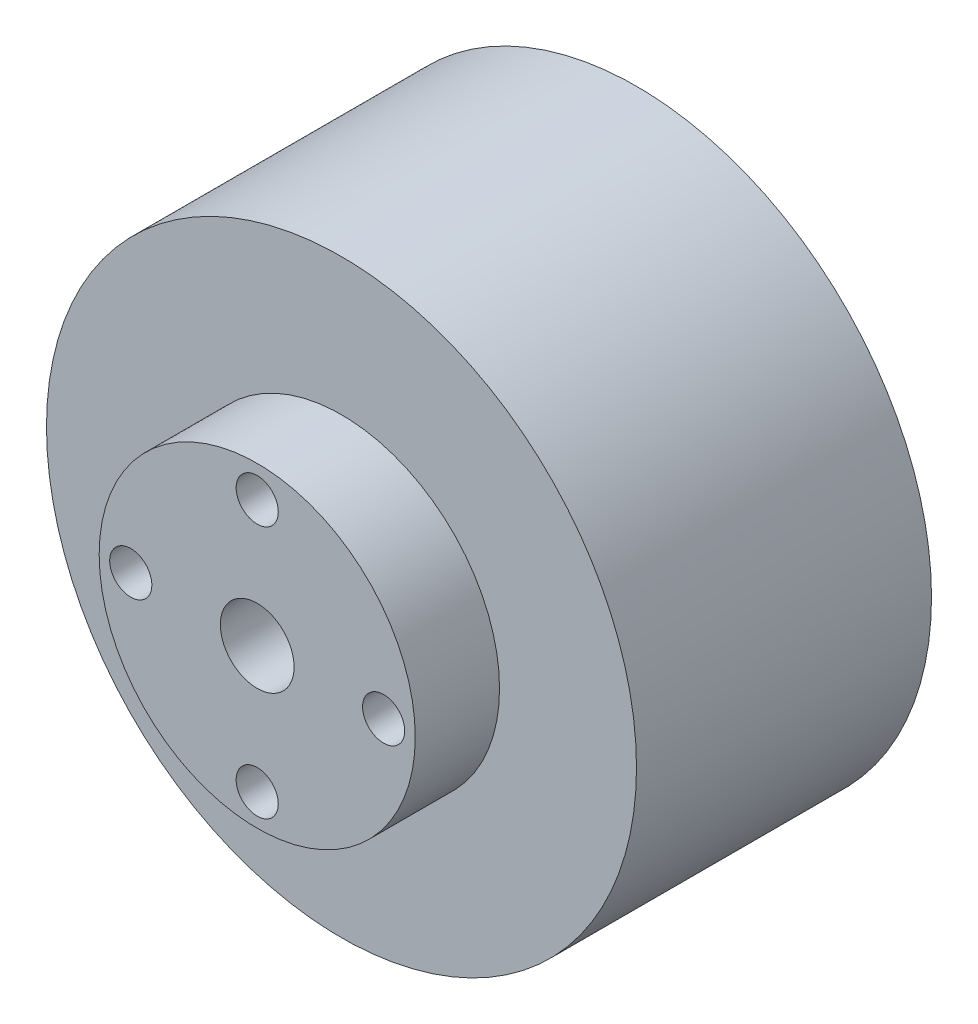
from build123d import *

# Parameters (mm, degrees)
SKETCH_1_R          = 14
EXTRUDE_1_DEPTH     = 14
SKETCH_3_R          = 7.5
EXTRUDE_3_DEPTH     = 4
SKETCH_4_R          = 1.75
CUT_EXTRUDE_1_DEPTH = 27.758176321
SKETCH_5_R          = 1
CUT_EXTRUDE_2_DEPTH = 3
SKETCH_6_R          = 1.5
CUT_EXTRUDE_3_DEPTH = 3


with BuildPart() as part:
    # 草图1 → 凸台-拉伸1 (new body)
    with BuildSketch(Plane.XY):
        Circle(SKETCH_1_R)
    extrude(amount=EXTRUDE_1_DEPTH)

    # 草图3 → 凸台-拉伸3 (add)
    with BuildSketch(Plane.XY.offset(14)):
        Circle(SKETCH_3_R)
    extrude(amount=EXTRUDE_3_DEPTH)

    # 草图4 → 切除-拉伸1 (cut, through all)
    with BuildSketch(Plane.XY.offset(18)):
        Circle(SKETCH_4_R)
    extrude(amount=-CUT_EXTRUDE_1_DEPTH, mode=Mode.SUBTRACT)

    # 草图5 → 切除-拉伸2 (cut)
    with BuildSketch(Plane.XY.offset(18)):
        with Locations((0, -6)):
            Circle(SKETCH_5_R)
        with Locations((-6, 0)):
            Circle(SKETCH_5_R)
        with Locations((0, 6)):
            Circle(SKETCH_5_R)
        with Locations((6, 0)):
            Circle(SKETCH_5_R)
    extrude(amount=-CUT_EXTRUDE_2_DEPTH, mode=Mode.SUBTRACT)

    # 草图6 → 切除-拉伸3 (cut)
    with BuildSketch(Plane.XY):
        with Locations((0, 8)):
            Circle(SKETCH_6_R)
        with Locations((-8, 0)):
            Circle(SKETCH_6_R)
        with Locations((0, -8)):
            Circle(SKETCH_6_R)
        with Locations((8, 0)):
            Circle(SKETCH_6_R)
    extrude(amount=CUT_EXTRUDE_3_DEPTH, mode=Mode.SUBTRACT)


solid = part.part
